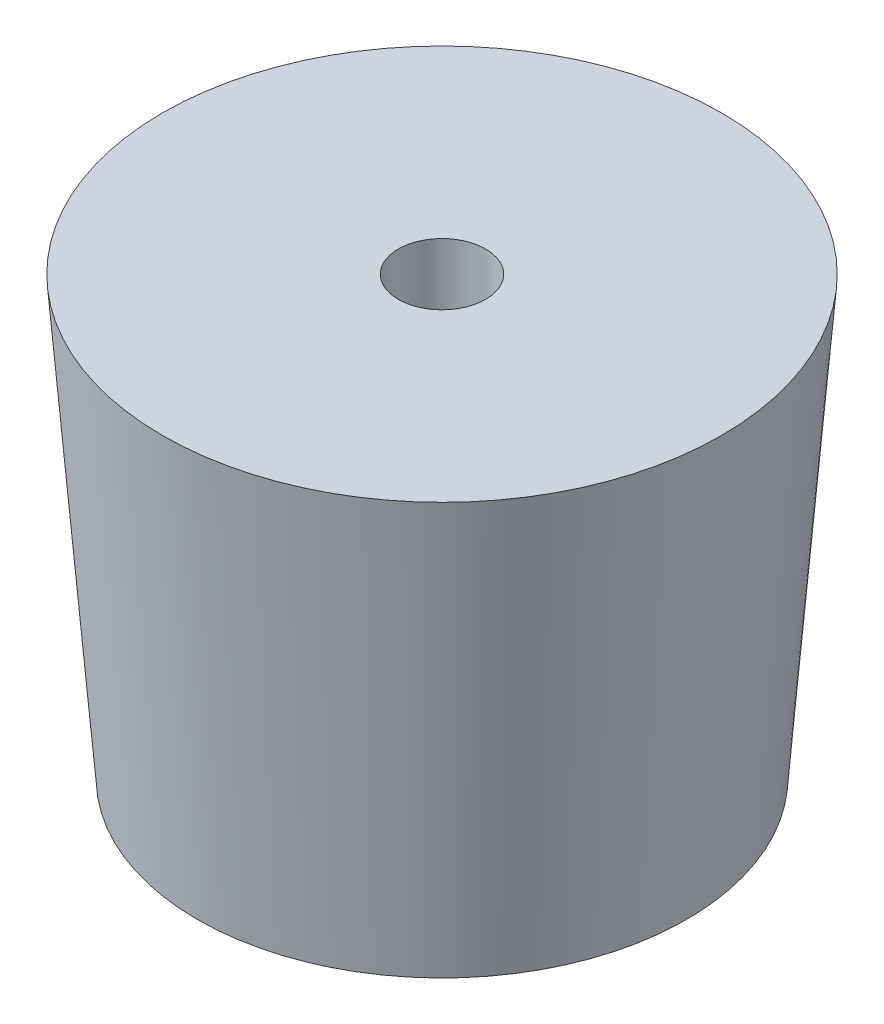
from build123d import *


with BuildPart() as part:
    # Sketch1 → Revolve1 (revolve)
    with BuildSketch(Plane.XY, mode=Mode.PRIVATE) as revolve1_sk:
        Polygon((2.5, 0), (2.5, -16), (7, -16), (7, -25), (14, -25), (16, 0), align=None)
    revolve(revolve1_sk.sketch.rotate(Axis((0, 0, 0), (0, -1, 0)), 90), axis=Axis((0, 0, 0), (0, -1, 0)))


solid = part.part
